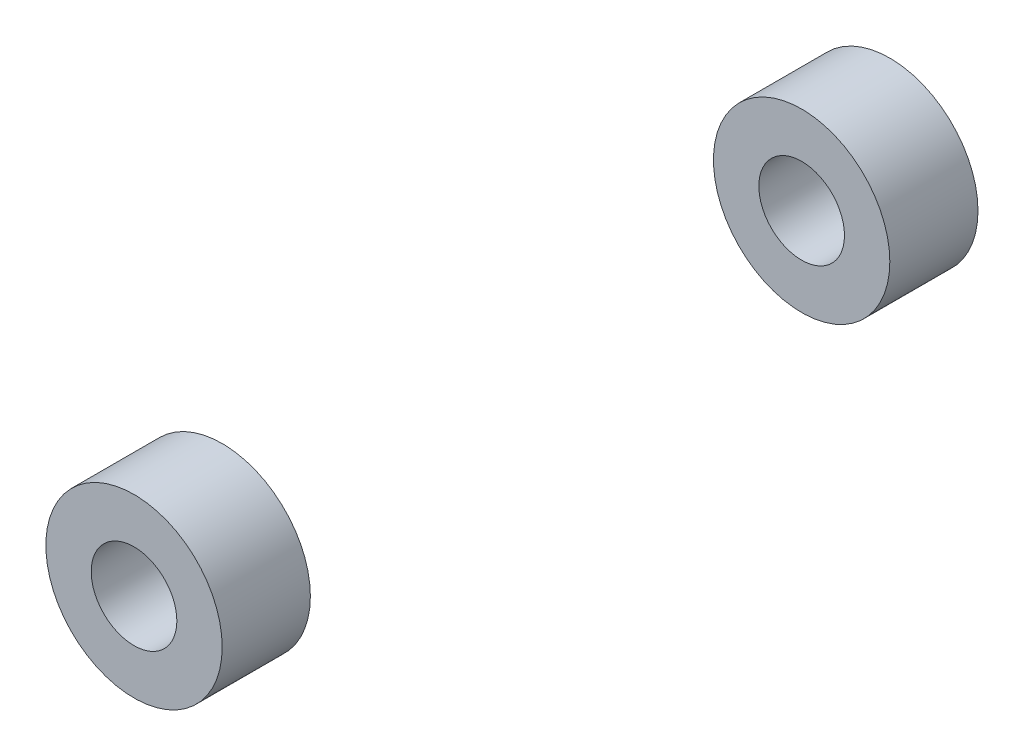
from build123d import *

# Parameters (mm, degrees)
SKETCH_1_R          = 3.5
SKETCH_1_R_2        = 1.7
EXTRUDE_1_DEPTH     = 30
SKETCH_2_R          = 3.5
CUT_EXTRUDE_1_DEPTH = 11.5


with BuildPart() as part:
    # 草图1 → 凸台-拉伸1 (new body)
    with BuildSketch(Plane.XY):
        Circle(SKETCH_1_R)
        Circle(SKETCH_1_R_2, mode=Mode.SUBTRACT)
    extrude(amount=EXTRUDE_1_DEPTH)

    # 草图2 → 切除-拉伸1 (cut, symmetric)
    with BuildSketch(Plane.XY.offset(15)):
        Circle(SKETCH_2_R)
    extrude(amount=CUT_EXTRUDE_1_DEPTH, both=True, mode=Mode.SUBTRACT)


with BuildPart() as cut_extrude_1_piece_1:
    # of the separate pieces the step leaves, piece 1, a body of its own (cut_extrude_1_pieces)
    add(part.part.solids().sort_by_distance((3.5, 0, 0))[0])


with BuildPart() as cut_extrude_1_piece_2:
    # of the separate pieces the step leaves, piece 2, a body of its own (cut_extrude_1_pieces)
    add(part.part.solids().sort_by_distance((3.5, 0, 26.5))[0])


solid = Compound([cut_extrude_1_piece_1.part, cut_extrude_1_piece_2.part])
